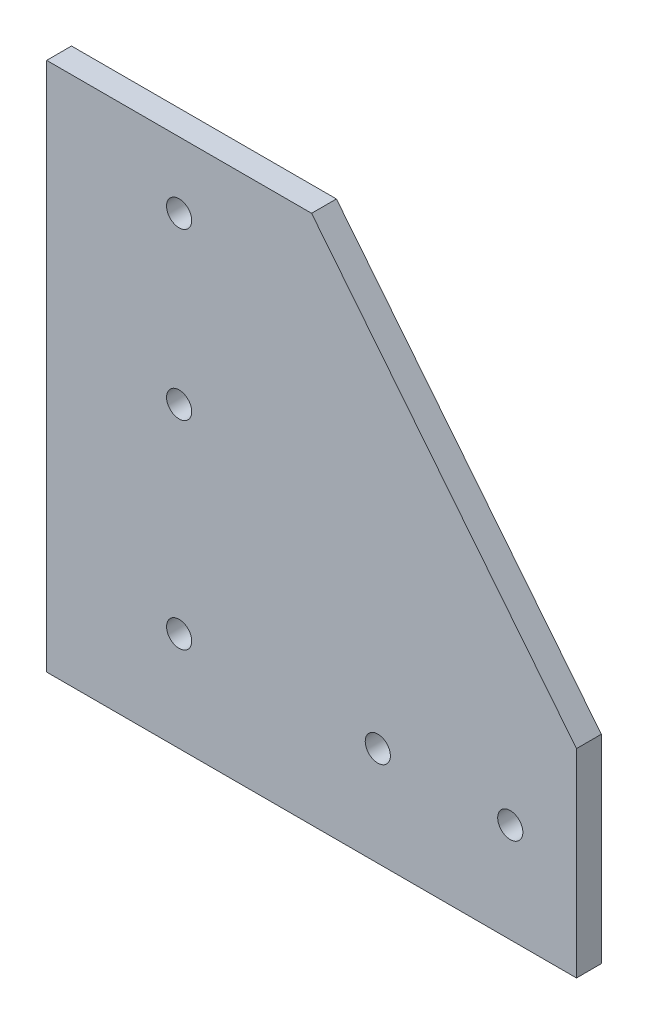
from build123d import *

# Parameters (mm, degrees)
SKETCH1_R           = 2.413
BOSS_EXTRUDE1_DEPTH = 4.7625


with BuildPart() as part:
    # Sketch1 → Boss-Extrude1 (new body)
    with BuildSketch(Plane.XY):
        Polygon((101.6, 38.1), (50.8, 101.6), (0, 101.6), (0, 0), (101.6, 0), align=None)
        with Locations(Location((25.4, 19.05, 0), (0, 0, 180))):
            Circle(SKETCH1_R, mode=Mode.SUBTRACT)
        with Locations(Location((63.5, 19.05, 0), (0, 0, 180))):
            Circle(SKETCH1_R, mode=Mode.SUBTRACT)
        with Locations(Location((88.9, 19.05, 0), (0, 0, 180))):
            Circle(SKETCH1_R, mode=Mode.SUBTRACT)
        with Locations(Location((25.4, 57.15, 0), (0, 0, 180))):
            Circle(SKETCH1_R, mode=Mode.SUBTRACT)
        with Locations(Location((25.4, 88.9, 0), (0, 0, 180))):
            Circle(SKETCH1_R, mode=Mode.SUBTRACT)
    extrude(amount=BOSS_EXTRUDE1_DEPTH)


solid = part.part
